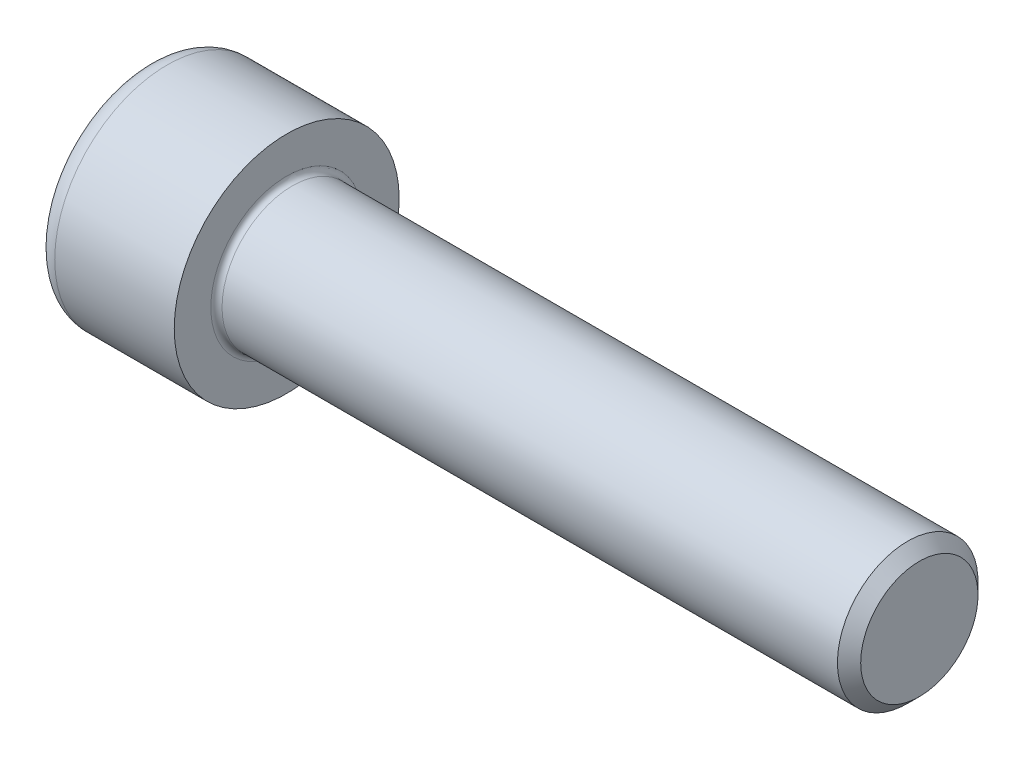
from build123d import *

# Parameters (mm, degrees)
FILLET1_R   = 0.4
FILLET2_R   = 1.5
HEX_2_DEPTH = 5


with BuildPart() as part:
    # BodySke → Base-Revolve (revolve)
    with BuildSketch(Plane.XY, mode=Mode.PRIVATE) as base_revolve_sk:
        Polygon((0, 0), (0, 8), (10, 8), (10, 5), (54.172, 5), (55, 4.172), (55, 0), align=None)
    revolve(base_revolve_sk.sketch.rotate(Axis((-31.75, 0, 0), (1, 0, 0)), 90), axis=Axis((-31.75, 0, 0), (1, 0, 0)))

    # Fillet1
    fillet1_edges = [part.edges().sort_by_distance(p)[0] for p in [
        (10, 0, -5),
    ]]
    fillet(fillet1_edges, radius=FILLET1_R)

    # Fillet2
    fillet2_edges = [part.edges().sort_by_distance(p)[0] for p in [
        (0, 0, -8),
    ]]
    fillet(fillet2_edges, radius=FILLET2_R)

    # Sketch2 → Hex-PreBroach (revolve, cut)
    with BuildSketch(Plane.XY, mode=Mode.PRIVATE) as hex_prebroach_sk:
        Polygon((0, 4.0575), (5, 4.0575), (7.342598717, 0), (0, 0), align=None)
    revolve(hex_prebroach_sk.sketch.rotate(Axis((0, 0, 0), (1, 0, 0)), 90), axis=Axis((0, 0, 0), (1, 0, 0)), mode=Mode.SUBTRACT)

    # Sketch3 → Hex 2 (cut)
    with BuildSketch(Plane(origin=(0, 0, 0), x_dir=(0, 0.500000000000001, 0.866025403784438), z_dir=(-1, 0, 0))):
        Polygon((2.342598717, 4.0575), (-2.342598717, 4.0575), (-4.685197434, 0), (-2.342598717, -4.0575), (2.342598717, -4.0575), (4.685197434, 0), align=None)
    extrude(amount=-HEX_2_DEPTH, mode=Mode.SUBTRACT)


solid = part.part
